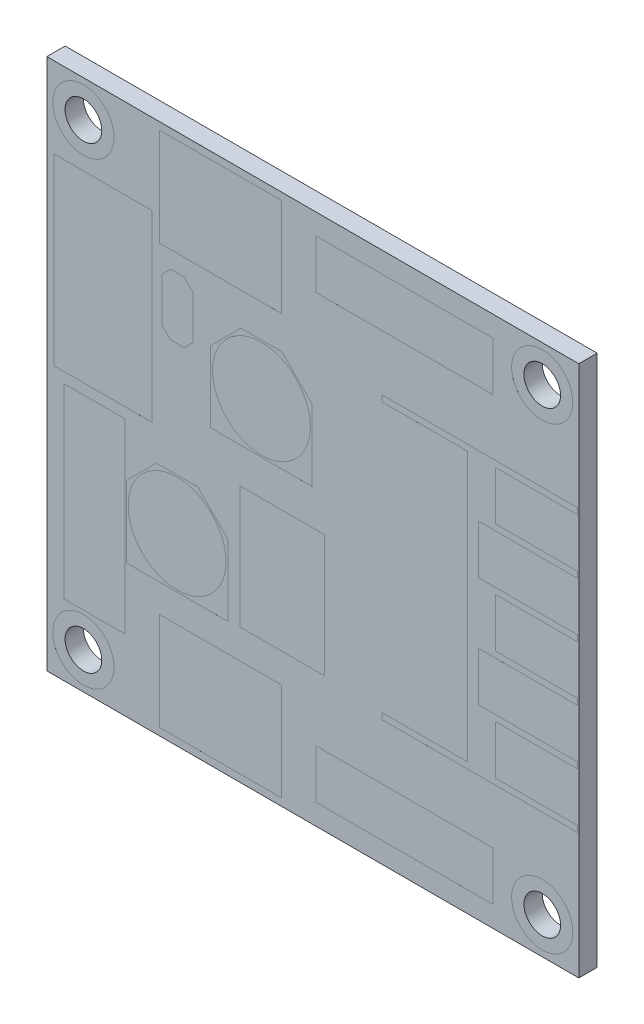
from build123d import *

# Parameters (mm, degrees)
SKETCH1_W           = 43.5
SKETCH1_H           = 43.5
SKETCH1_R           = 1.5
BOSS_EXTRUDE1_DEPTH = 1.5
CUT_EXTRUDE1_START  = -0.0001
SKETCH2_R           = 2.5
SKETCH2_R_2         = 1.5
CUT_EXTRUDE1_DEPTH  = 0.0001
SKETCH3_R           = 2.5
SKETCH3_R_2         = 1.5
CUT_EXTRUDE2_DEPTH  = 0.002
CUT_EXTRUDE4_DEPTH  = 0.0001
SKETCH6_W           = 8
SKETCH6_H           = 15
SKETCH6_W_2         = 10
SKETCH6_H_2         = 8
CUT_EXTRUDE5_DEPTH  = 0.0001
SKETCH8_R           = 4
CUT_EXTRUDE6_DEPTH  = 0.0001
SKETCH9_W           = 14.5
SKETCH9_H           = 4
CUT_EXTRUDE7_DEPTH  = 0.0001
SKETCH10_W          = 5
SKETCH10_H          = 15.24
CUT_EXTRUDE8_DEPTH  = 0.0001
SKETCH11_R          = 4
SKETCH11_W          = 14.5
SKETCH11_H          = 4
CUT_EXTRUDE9_DEPTH  = 0.0001
CUT_EXTRUDE10_DEPTH = 0.0001
SKETCH13_W          = 6.9
SKETCH13_H          = 10
CUT_EXTRUDE11_DEPTH = 0.0001


with BuildPart() as part:
    # Sketch1 → Boss-Extrude1 (new body)
    with BuildSketch(Plane.XY):
        Rectangle(SKETCH1_W, SKETCH1_H)
        with Locations((-18.758938316, 18.758938316)):
            Circle(SKETCH1_R, mode=Mode.SUBTRACT)
        with Locations((18.758938316, 18.758938316)):
            Circle(SKETCH1_R, mode=Mode.SUBTRACT)
        with Locations((18.758938316, -18.758938316)):
            Circle(SKETCH1_R, mode=Mode.SUBTRACT)
        with Locations((-18.758938316, -18.758938316)):
            Circle(SKETCH1_R, mode=Mode.SUBTRACT)
    extrude(amount=BOSS_EXTRUDE1_DEPTH)

    # Sketch2 → Cut-Extrude1 (cut)
    # profile 1 of 4: a face of its own
    with BuildSketch(Plane.XY.offset(1.5).offset(CUT_EXTRUDE1_START)):
        with Locations((-18.758938316, 18.758938316)):
            Circle(SKETCH2_R)
        with Locations((-18.758938316, 18.758938316)):
            Circle(SKETCH2_R_2, mode=Mode.SUBTRACT)
    # profile 2 of 4: a face of its own
    with BuildSketch(Plane.XY.offset(1.5).offset(CUT_EXTRUDE1_START)):
        with Locations((18.758938316, 18.758938316)):
            Circle(SKETCH2_R)
        with Locations((18.758938316, 18.758938316)):
            Circle(SKETCH2_R_2, mode=Mode.SUBTRACT)
    # profile 3 of 4: a face of its own
    with BuildSketch(Plane.XY.offset(1.5).offset(CUT_EXTRUDE1_START)):
        with Locations((18.758938316, -18.758938316)):
            Circle(SKETCH2_R)
        with Locations((18.758938316, -18.758938316)):
            Circle(SKETCH2_R_2, mode=Mode.SUBTRACT)
    # profile 4 of 4: a face of its own
    with BuildSketch(Plane.XY.offset(1.5).offset(CUT_EXTRUDE1_START)):
        with Locations((-18.758938316, -18.758938316)):
            Circle(SKETCH2_R)
        with Locations((-18.758938316, -18.758938316)):
            Circle(SKETCH2_R_2, mode=Mode.SUBTRACT)
    extrude(amount=CUT_EXTRUDE1_DEPTH, mode=Mode.SUBTRACT)

    # Sketch3 → Cut-Extrude2 (cut)
    # profile 1 of 4: a face of its own
    with BuildSketch(Plane(origin=(0, 0, 0), x_dir=(-1, 0, 0), z_dir=(0, 0, -1))):
        with Locations((-18.758938316, -18.758938316)):
            Circle(SKETCH3_R)
        with Locations((-18.758938316, -18.758938316)):
            Circle(SKETCH3_R_2, mode=Mode.SUBTRACT)
    # profile 2 of 4: a face of its own
    with BuildSketch(Plane(origin=(0, 0, 0), x_dir=(-1, 0, 0), z_dir=(0, 0, -1))):
        with Locations((-18.758938316, 18.758938316)):
            Circle(SKETCH3_R)
        with Locations((-18.758938316, 18.758938316)):
            Circle(SKETCH3_R_2, mode=Mode.SUBTRACT)
    # profile 3 of 4: a face of its own
    with BuildSketch(Plane(origin=(0, 0, 0), x_dir=(-1, 0, 0), z_dir=(0, 0, -1))):
        with Locations((18.758938316, 18.758938316)):
            Circle(SKETCH3_R)
        with Locations((18.758938316, 18.758938316)):
            Circle(SKETCH3_R_2, mode=Mode.SUBTRACT)
    # profile 4 of 4: a face of its own
    with BuildSketch(Plane(origin=(0, 0, 0), x_dir=(-1, 0, 0), z_dir=(0, 0, -1))):
        with Locations((18.758938316, -18.758938316)):
            Circle(SKETCH3_R)
        with Locations((18.758938316, -18.758938316)):
            Circle(SKETCH3_R_2, mode=Mode.SUBTRACT)
    extrude(amount=-CUT_EXTRUDE2_DEPTH, mode=Mode.SUBTRACT)

    # Sketch4 → Cut-Extrude4 (cut)
    with BuildSketch(Plane.XY.offset(1.5)):
        Polygon((14.95, 11), (21.65, 11), (21.65, 11.5), (5.65, 11.5), (5.65, 11), (12.65, 11), (12.65, -11), (5.65, -11), (5.65, -11.5), (21.65, -11.5), (21.65, -11), (14.95, -11), (14.95, -7), (21.65, -7), (21.65, -6.5), (13.55, -6.5), (13.55, -2.5), (21.65, -2.5), (21.65, -2), (14.95, -2), (14.95, 2), (21.65, 2), (21.65, 2.5), (13.55, 2.5), (13.55, 6.5), (21.65, 6.5), (21.65, 7), (14.95, 7), align=None)
    extrude(amount=-CUT_EXTRUDE4_DEPTH, mode=Mode.SUBTRACT)

    # Sketch6 → Cut-Extrude5 (cut)
    with BuildSketch(Plane.XY.offset(1.5)):
        with Locations((-17.15, 7.65)):
            Rectangle(SKETCH6_W, SKETCH6_H)
        with Locations((-7.55, 17.15)):
            Rectangle(SKETCH6_W_2, SKETCH6_H_2)
        with Locations((-7.55, -17.15)):
            Rectangle(SKETCH6_W_2, SKETCH6_H_2)
    extrude(amount=-CUT_EXTRUDE5_DEPTH, mode=Mode.SUBTRACT)

    # Sketch8 → Cut-Extrude6 (cut)
    with BuildSketch(Plane.XY.offset(1.5)):
        Polygon((-0.05, 7.98), (-2.52, 10.45), (-5.88, 10.45), (-8.35, 7.98), (-8.35, 2.15), (-0.05, 2.15), align=None)
        with Locations((-4.2, 6.3)):
            Circle(SKETCH8_R, mode=Mode.SUBTRACT)
    extrude(amount=-CUT_EXTRUDE6_DEPTH, mode=Mode.SUBTRACT)

    # Sketch9 → Cut-Extrude7 (cut)
    with BuildSketch(Plane.XY.offset(1.5)):
        with Locations((7.5, 18.05)):
            Rectangle(SKETCH9_W, SKETCH9_H)
    extrude(amount=-CUT_EXTRUDE7_DEPTH, mode=Mode.SUBTRACT)

    # Sketch10 → Cut-Extrude8 (cut)
    with BuildSketch(Plane.XY.offset(1.5)):
        with Locations((-17.85, -8.33)):
            Rectangle(SKETCH10_W, SKETCH10_H)
    extrude(amount=-CUT_EXTRUDE8_DEPTH, mode=Mode.SUBTRACT)

    # Sketch11 → Cut-Extrude9 (cut)
    # profile 1 of 2: a face of its own
    with BuildSketch(Plane.XY.offset(1.5)):
        Polygon((-9.42, -2.55), (-12.78, -2.55), (-15.25, -5.02), (-15.25, -10.85), (-6.95, -10.85), (-6.95, -5.02), align=None)
        with Locations((-11.1, -6.7)):
            Circle(SKETCH11_R, mode=Mode.SUBTRACT)
    # profile 2 of 2: a face of its own
    with BuildSketch(Plane.XY.offset(1.5)):
        with Locations((7.5, -18.05)):
            Rectangle(SKETCH11_W, SKETCH11_H)
    extrude(amount=-CUT_EXTRUDE9_DEPTH, mode=Mode.SUBTRACT)

    # Sketch12 → Cut-Extrude10 (cut)
    with BuildSketch(Plane.XY.offset(1.5)):
        Polygon((-9.81, 11.04), (-10.52, 11.75), (-11.64, 11.75), (-12.35, 11.04), (-12.35, 7.46), (-11.64, 6.75), (-10.52, 6.75), (-9.81, 7.46), align=None)
    extrude(amount=-CUT_EXTRUDE10_DEPTH, mode=Mode.SUBTRACT)

    # Sketch13 → Cut-Extrude11 (cut)
    with BuildSketch(Plane.XY.offset(1.5)):
        with Locations((-2.5, -5.75)):
            Rectangle(SKETCH13_W, SKETCH13_H)
    extrude(amount=-CUT_EXTRUDE11_DEPTH, mode=Mode.SUBTRACT)


solid = part.part
